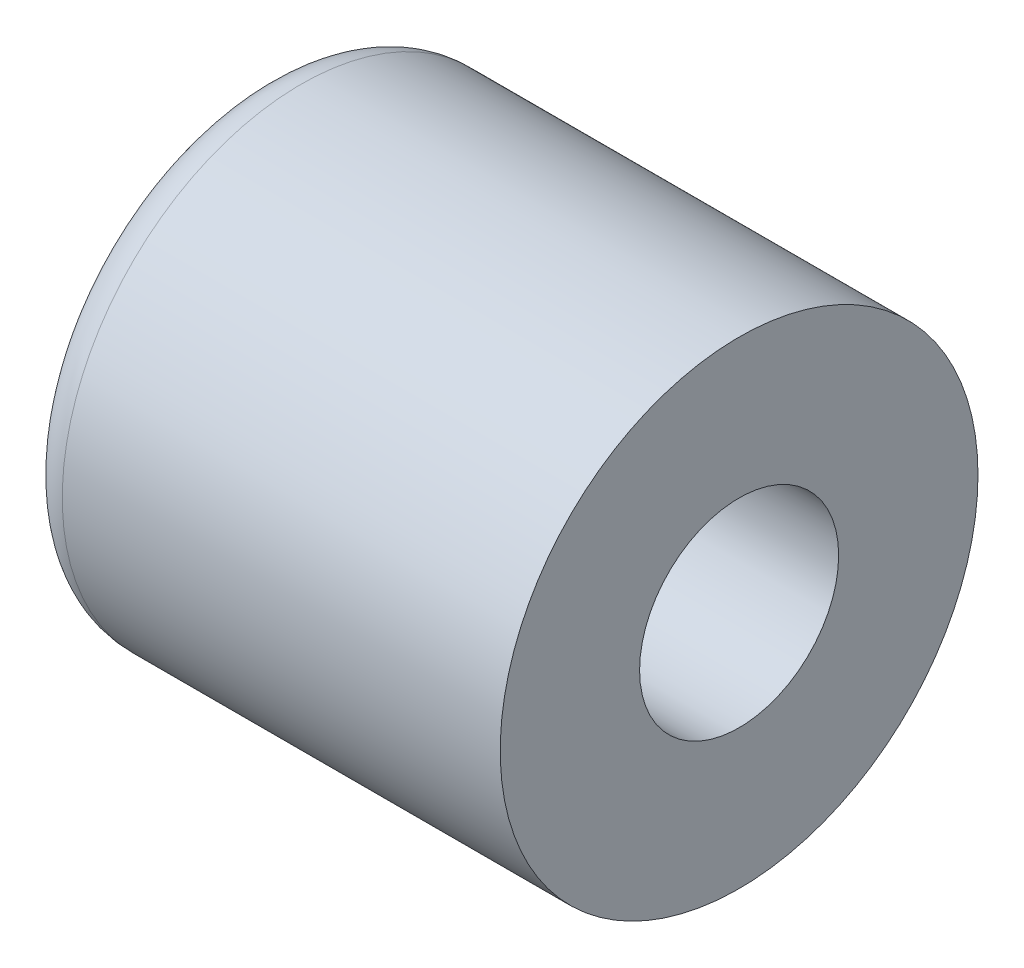
from build123d import *

# Parameters (mm, degrees)
SKETCH1_R           = 6
SKETCH1_R_2         = 2.5
BOSS_EXTRUDE1_DEPTH = 12
FILLET1_R           = 1


with BuildPart() as part:
    # Sketch1 → Boss-Extrude1 (new body)
    with BuildSketch(Plane(origin=(0, 0, 0), x_dir=(0, 0, -1), z_dir=(1, 0, 0))):
        Circle(SKETCH1_R)
        Circle(SKETCH1_R_2, mode=Mode.SUBTRACT)
    extrude(amount=BOSS_EXTRUDE1_DEPTH)

    # Fillet1
    fillet1_edges = [part.edges().sort_by_distance(p)[0] for p in [
        (0, 0, 6),
    ]]
    fillet(fillet1_edges, radius=FILLET1_R)


solid = part.part
